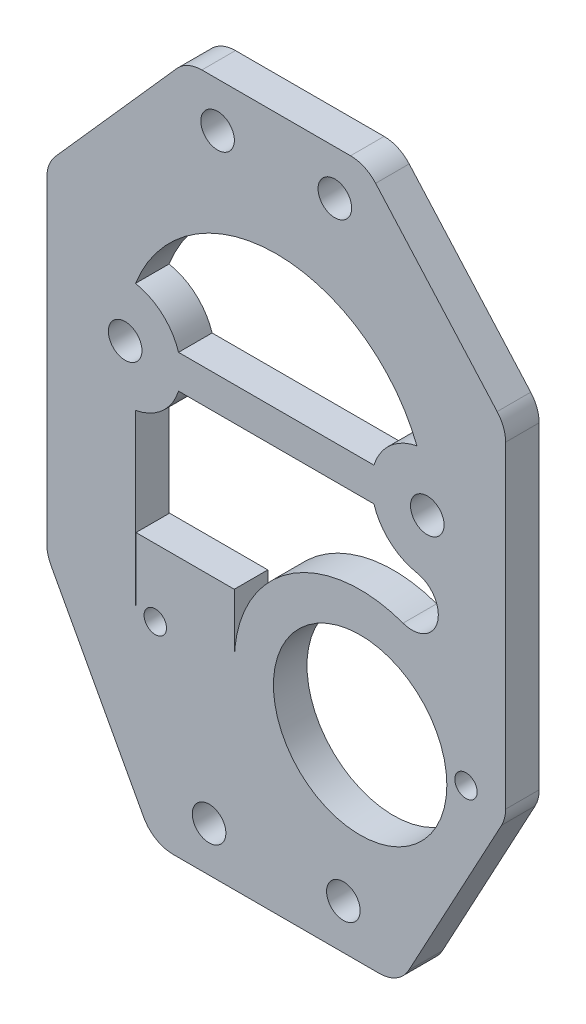
from build123d import *

# Parameters (mm, degrees)
SKETCH1_R           = 1.5
SKETCH1_R_2         = 7.75
BOSS_EXTRUDE1_DEPTH = 3
FILLET1_R           = 3
SKETCH2_R           = 1
CUT_EXTRUDE1_DEPTH  = 10


with BuildPart() as part:
    # Sketch1 → Boss-Extrude1 (new body)
    with BuildSketch(Plane.XY):
        Polygon((7.989824602, 62), (-7.989824602, 62), (-20.5, 47.899715907), (-20.5, 17.599715907), (-11, 0), (0, 0), (11, 0), (20.5, 17.599715907), (20.5, 47.899715907), align=None)
        with Locations((-6, 4)):
            Circle(SKETCH1_R, mode=Mode.SUBTRACT)
        with Locations((-13.5, 37.599715907)):
            Circle(SKETCH1_R, mode=Mode.SUBTRACT)
        with Locations((-5.239824602, 58)):
            Circle(SKETCH1_R, mode=Mode.SUBTRACT)
        with Locations(Location((5.239824602, 58, 0), (0, 0, 180))):
            Circle(SKETCH1_R, mode=Mode.SUBTRACT)
        with Locations(Location((13.5, 37.599715907, 0), (0, 0, 180))):
            Circle(SKETCH1_R, mode=Mode.SUBTRACT)
        with Locations(Location((6, 4, 0), (0, 0, 180))):
            Circle(SKETCH1_R, mode=Mode.SUBTRACT)
        with Locations((7.5, 17.599715907)):
            Circle(SKETCH1_R_2, mode=Mode.SUBTRACT)
        with BuildLine():
            Line((8.730303993, 36.099715907), (-8.730303993, 36.099715907))
            ThreePointArc((-8.730303993, 36.099715907), (-10.179901517, 33.861140502), (-12.574074074, 32.686197699))
            Line((-12.574074074, 32.686197699), (-12.574074074, 17.599715907))
            Line((-12.574074074, 17.599715907), (-12.52949298, 17.599715907))
            Line((-12.52949298, 17.599715907), (-12.52949298, 23.253614409))
            Line((-12.52949298, 23.253614409), (-3.75, 23.253614409))
            Line((-3.75, 23.253614409), (-3.75, 17.599715907))
            ThreePointArc((-3.75, 17.599715907), (1.043381087, 26.812455576), (11.338812838, 28.174497985))
            ThreePointArc((11.338812838, 28.174497985), (14.402792388, 29.760560356), (12.574074074, 32.686197699))
            ThreePointArc((12.574074074, 32.686197699), (10.179901517, 33.861140502), (8.730303993, 36.099715907))
        make_face(mode=Mode.SUBTRACT)
        with BuildLine():
            Line((8.730303993, 39.099715907), (-8.730303993, 39.099715907))
            ThreePointArc((-8.730303993, 39.099715907), (-10.179901517, 41.338291312), (-12.574074074, 42.513234115))
            ThreePointArc((-12.574074074, 42.513234115), (0, 51.099715907), (12.574074074, 42.513234115))
            ThreePointArc((12.574074074, 42.513234115), (10.179901517, 41.338291312), (8.730303993, 39.099715907))
        make_face(mode=Mode.SUBTRACT)
    extrude(amount=BOSS_EXTRUDE1_DEPTH)

    # Fillet1
    fillet1_edges = [part.edges().sort_by_distance(p)[0] for p in [
        (-11, 0, 1.5),
        (-20.5, 17.599715907, 1.5),
        (-20.5, 47.899715907, 1.5),
        (-7.989824602, 62, 1.5),
        (7.989824602, 62, 1.5),
        (20.5, 47.899715907, 1.5),
        (20.5, 17.599715907, 1.5),
        (11, 0, 1.5),
    ]]
    fillet(fillet1_edges, radius=FILLET1_R)

    # Sketch2 → Cut-Extrude1 (cut)
    with BuildSketch(Plane.XY.offset(3)):
        with Locations((16.960133769, 18.410352932)):
            Circle(SKETCH2_R)
        with Locations((-10.808600311, 17.213150766)):
            Circle(SKETCH2_R)
    extrude(amount=-CUT_EXTRUDE1_DEPTH, mode=Mode.SUBTRACT)


solid = part.part
